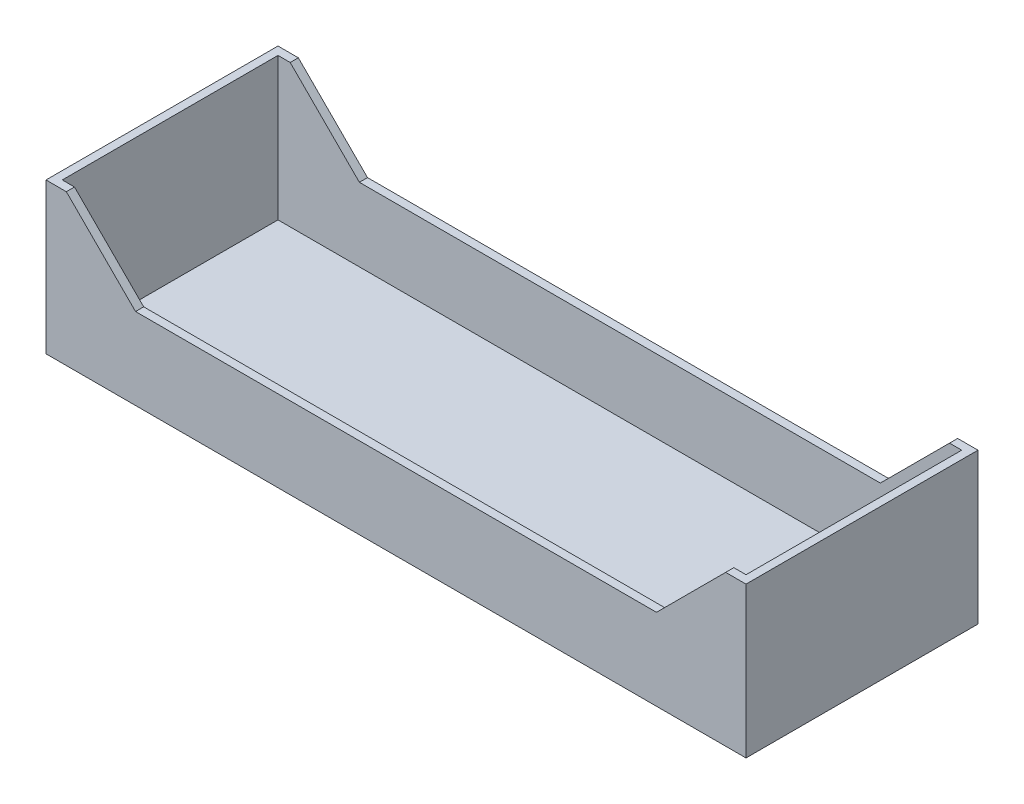
from build123d import *

# Parameters (mm, degrees)
SKETCH_1_W          = 172
SKETCH_1_H          = 57
EXTRUDE_1_DEPTH     = 2
SKETCH_3_W          = 172
SKETCH_3_H          = 57
SKETCH_3_W_2        = 168
SKETCH_3_H_2        = 53
EXTRUDE_2_DEPTH     = 35
CUT_EXTRUDE_1_DEPTH = 110.608393839


with BuildPart() as part:
    # 草图1 → 凸台-拉伸1 (new body)
    with BuildSketch(Plane(origin=(0, 0, 0), x_dir=(1, 0, 0), z_dir=(0, 1, 0))):
        Rectangle(SKETCH_1_W, SKETCH_1_H)
    extrude(amount=EXTRUDE_1_DEPTH)

    # 草图3 → 凸台-拉伸2 (add)
    with BuildSketch(Plane(origin=(0, 2, 0), x_dir=(1, 0, 0), z_dir=(0, 1, 0))):
        Rectangle(SKETCH_3_W, SKETCH_3_H)
        Rectangle(SKETCH_3_W_2, SKETCH_3_H_2, mode=Mode.SUBTRACT)
    extrude(amount=EXTRUDE_2_DEPTH)

    # 草图4 → 切除-拉伸1 (cut, through all)
    with BuildSketch(Plane.XY.offset(28.5)):
        Polygon((-81, 37), (-64, 20), (64, 20), (81, 37), align=None)
    extrude(amount=-CUT_EXTRUDE_1_DEPTH, mode=Mode.SUBTRACT)


solid = part.part
